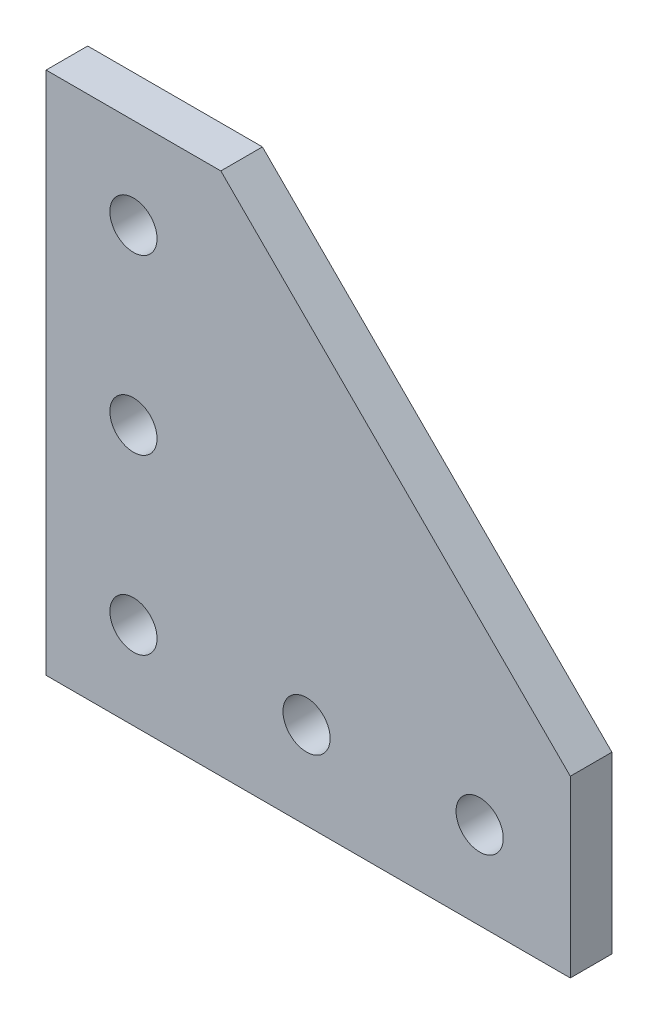
from build123d import *

# Parameters (mm, degrees)
SKETCH1_R           = 2.7
BOSS_EXTRUDE1_DEPTH = 2.38125


with BuildPart() as part:
    # Sketch1 → Boss-Extrude1 (new, symmetric)
    with BuildSketch(Plane.XY):
        Polygon((0, 0), (0, 60), (20, 60), (60, 20), (60, 0), align=None)
        with Locations(Location((10, 10, 0), (0, 0, 180))):
            Circle(SKETCH1_R, mode=Mode.SUBTRACT)
        with Locations(Location((29.812, 10, 0), (0, 0, 180))):
            Circle(SKETCH1_R, mode=Mode.SUBTRACT)
        with Locations(Location((49.624, 10, 0), (0, 0, 180))):
            Circle(SKETCH1_R, mode=Mode.SUBTRACT)
        with Locations(Location((10, 29.812, 0), (0, 0, 180))):
            Circle(SKETCH1_R, mode=Mode.SUBTRACT)
        with Locations(Location((10, 49.624, 0), (0, 0, 180))):
            Circle(SKETCH1_R, mode=Mode.SUBTRACT)
    extrude(amount=BOSS_EXTRUDE1_DEPTH, both=True)


solid = part.part
